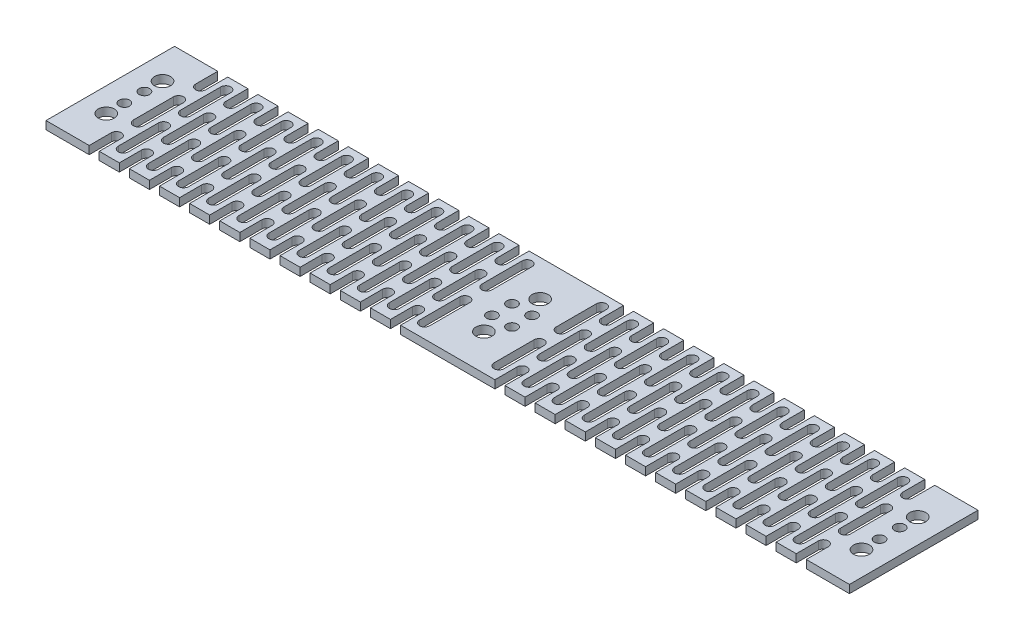
from build123d import *

# Parameters (mm, degrees)
SKETCH_1_W          = 100
SKETCH_1_H          = 16
EXTRUDE_1_DEPTH     = 1
SKETCH_2_R          = 1
SKETCH_2_R_2        = 0.65
CUT_EXTRUDE_1_DEPTH = 51.645829048
CUT_EXTRUDE_2_DEPTH = 51.645829048


with BuildPart() as part:
    # 스케치1 → 보스-돌출1 (new body)
    with BuildSketch(Plane(origin=(0, 0, 0), x_dir=(1, 0, 0), z_dir=(0, 1, 0))):
        Rectangle(SKETCH_1_W, SKETCH_1_H)
    extrude(amount=EXTRUDE_1_DEPTH)

    # 스케치2 → 컷-돌출1 (cut, through all)
    with BuildSketch(Plane(origin=(0, 1, 0), x_dir=(1, 0, 0), z_dir=(0, 1, 0))):
        with Locations(Location((47, 3.5, 0), (0, 0, 270))):
            Circle(SKETCH_2_R)
        with Locations(Location((0, 3.5, 0), (0, 0, 270))):
            Circle(SKETCH_2_R)
        with Locations(Location((-47, 3.5, 0), (0, 0, 270))):
            Circle(SKETCH_2_R)
        with Locations(Location((47, 1.25, 0), (0, 0, 270))):
            Circle(SKETCH_2_R_2)
        with Locations(Location((-47, 1.25, 0), (0, 0, 90))):
            Circle(SKETCH_2_R_2)
        with Locations(Location((1.25, 1.25, 0), (0, 0, 270))):
            Circle(SKETCH_2_R_2)
        with Locations(Location((-1.25, 1.25, 0), (0, 0, 270))):
            Circle(SKETCH_2_R_2)
        with Locations(Location((47, -1.25, 0), (0, 0, 90))):
            Circle(SKETCH_2_R_2)
        with Locations(Location((47, -3.5, 0), (0, 0, 90))):
            Circle(SKETCH_2_R)
        with Locations(Location((-1.25, -1.25, 0), (0, 0, 90))):
            Circle(SKETCH_2_R_2)
        with Locations(Location((1.25, -1.25, 0), (0, 0, 90))):
            Circle(SKETCH_2_R_2)
        with Locations(Location((0, -3.5, 0), (0, 0, 90))):
            Circle(SKETCH_2_R)
        with Locations(Location((-47, -1.25, 0), (0, 0, 270))):
            Circle(SKETCH_2_R_2)
        with Locations(Location((-47, -3.5, 0), (0, 0, 90))):
            Circle(SKETCH_2_R)
    extrude(amount=-CUT_EXTRUDE_1_DEPTH, mode=Mode.SUBTRACT)

    # 스케치3 → 컷-돌출2 (cut, through all)
    with BuildSketch(Plane(origin=(0, 1, 0), x_dir=(1, 0, 0), z_dir=(0, 1, 0))):
        with BuildLine():
            Line((44.625, 2.5), (44.625, -2.5))
            ThreePointArc((44.625, -2.5), (44, -3.125), (43.375, -2.5))
            Line((43.375, -2.5), (43.375, 2.5))
            ThreePointArc((43.375, 2.5), (44, 3.125), (44.625, 2.5))
        make_face()
        with BuildLine():
            Line((40.875, 2.5), (40.875, -2.5))
            ThreePointArc((40.875, -2.5), (40.25, -3.125), (39.625, -2.5))
            Line((39.625, -2.5), (39.625, 2.5))
            ThreePointArc((39.625, 2.5), (40.25, 3.125), (40.875, 2.5))
        make_face()
        with BuildLine():
            Line((37.125, 2.5), (37.125, -2.5))
            ThreePointArc((37.125, -2.5), (36.5, -3.125), (35.875, -2.5))
            Line((35.875, -2.5), (35.875, 2.5))
            ThreePointArc((35.875, 2.5), (36.5, 3.125), (37.125, 2.5))
        make_face()
        with BuildLine():
            Line((33.375, 2.5), (33.375, -2.5))
            ThreePointArc((33.375, -2.5), (32.75, -3.125), (32.125, -2.5))
            Line((32.125, -2.5), (32.125, 2.5))
            ThreePointArc((32.125, 2.5), (32.75, 3.125), (33.375, 2.5))
        make_face()
        with BuildLine():
            Line((29.625, 2.5), (29.625, -2.5))
            ThreePointArc((29.625, -2.5), (29, -3.125), (28.375, -2.5))
            Line((28.375, -2.5), (28.375, 2.5))
            ThreePointArc((28.375, 2.5), (29, 3.125), (29.625, 2.5))
        make_face()
        with BuildLine():
            Line((25.875, 2.5), (25.875, -2.5))
            ThreePointArc((25.875, -2.5), (25.25, -3.125), (24.625, -2.5))
            Line((24.625, -2.5), (24.625, 2.5))
            ThreePointArc((24.625, 2.5), (25.25, 3.125), (25.875, 2.5))
        make_face()
        with BuildLine():
            Line((22.125, 2.5), (22.125, -2.5))
            ThreePointArc((22.125, -2.5), (21.5, -3.125), (20.875, -2.5))
            Line((20.875, -2.5), (20.875, 2.5))
            ThreePointArc((20.875, 2.5), (21.5, 3.125), (22.125, 2.5))
        make_face()
        with BuildLine():
            Line((18.375, 2.5), (18.375, -2.5))
            ThreePointArc((18.375, -2.5), (17.75, -3.125), (17.125, -2.5))
            Line((17.125, -2.5), (17.125, 2.5))
            ThreePointArc((17.125, 2.5), (17.75, 3.125), (18.375, 2.5))
        make_face()
        with BuildLine():
            Line((14.625, 2.5), (14.625, -2.5))
            ThreePointArc((14.625, -2.5), (14, -3.125), (13.375, -2.5))
            Line((13.375, -2.5), (13.375, 2.5))
            ThreePointArc((13.375, 2.5), (14, 3.125), (14.625, 2.5))
        make_face()
        with BuildLine():
            Line((10.875, 2.5), (10.875, -2.5))
            ThreePointArc((10.875, -2.5), (10.25, -3.125), (9.625, -2.5))
            Line((9.625, -2.5), (9.625, 2.5))
            ThreePointArc((9.625, 2.5), (10.25, 3.125), (10.875, 2.5))
        make_face()
        with BuildLine():
            Line((7.125, 2.5), (7.125, -2.5))
            ThreePointArc((7.125, -2.5), (6.5, -3.125), (5.875, -2.5))
            Line((5.875, -2.5), (5.875, 2.5))
            ThreePointArc((5.875, 2.5), (6.5, 3.125), (7.125, 2.5))
        make_face()
        with BuildLine():
            Line((40.875, 10.25), (40.875, 5.25))
            ThreePointArc((40.875, 5.25), (40.25, 4.625), (39.625, 5.25))
            Line((39.625, 5.25), (39.625, 10.25))
            ThreePointArc((39.625, 10.25), (40.25, 10.875), (40.875, 10.25))
        make_face()
        with BuildLine():
            Line((37.125, 10.25), (37.125, 5.25))
            ThreePointArc((37.125, 5.25), (36.5, 4.625), (35.875, 5.25))
            Line((35.875, 5.25), (35.875, 10.25))
            ThreePointArc((35.875, 10.25), (36.5, 10.875), (37.125, 10.25))
        make_face()
        with BuildLine():
            Line((33.375, 10.25), (33.375, 5.25))
            ThreePointArc((33.375, 5.25), (32.75, 4.625), (32.125, 5.25))
            Line((32.125, 5.25), (32.125, 10.25))
            ThreePointArc((32.125, 10.25), (32.75, 10.875), (33.375, 10.25))
        make_face()
        with BuildLine():
            Line((29.625, 10.25), (29.625, 5.25))
            ThreePointArc((29.625, 5.25), (29, 4.625), (28.375, 5.25))
            Line((28.375, 5.25), (28.375, 10.25))
            ThreePointArc((28.375, 10.25), (29, 10.875), (29.625, 10.25))
        make_face()
        with BuildLine():
            Line((25.875, 10.25), (25.875, 5.25))
            ThreePointArc((25.875, 5.25), (25.25, 4.625), (24.625, 5.25))
            Line((24.625, 5.25), (24.625, 10.25))
            ThreePointArc((24.625, 10.25), (25.25, 10.875), (25.875, 10.25))
        make_face()
        with BuildLine():
            Line((22.125, 10.25), (22.125, 5.25))
            ThreePointArc((22.125, 5.25), (21.5, 4.625), (20.875, 5.25))
            Line((20.875, 5.25), (20.875, 10.25))
            ThreePointArc((20.875, 10.25), (21.5, 10.875), (22.125, 10.25))
        make_face()
        with BuildLine():
            Line((18.375, 10.25), (18.375, 5.25))
            ThreePointArc((18.375, 5.25), (17.75, 4.625), (17.125, 5.25))
            Line((17.125, 5.25), (17.125, 10.25))
            ThreePointArc((17.125, 10.25), (17.75, 10.875), (18.375, 10.25))
        make_face()
        with BuildLine():
            Line((14.625, 10.25), (14.625, 5.25))
            ThreePointArc((14.625, 5.25), (14, 4.625), (13.375, 5.25))
            Line((13.375, 5.25), (13.375, 10.25))
            ThreePointArc((13.375, 10.25), (14, 10.875), (14.625, 10.25))
        make_face()
        with BuildLine():
            Line((10.875, 10.25), (10.875, 5.25))
            ThreePointArc((10.875, 5.25), (10.25, 4.625), (9.625, 5.25))
            Line((9.625, 5.25), (9.625, 10.25))
            ThreePointArc((9.625, 10.25), (10.25, 10.875), (10.875, 10.25))
        make_face()
        with BuildLine():
            Line((7.125, 10.25), (7.125, 5.25))
            ThreePointArc((7.125, 5.25), (6.5, 4.625), (5.875, 5.25))
            Line((5.875, 5.25), (5.875, 10.25))
            ThreePointArc((5.875, 10.25), (6.5, 10.875), (7.125, 10.25))
        make_face()
        with BuildLine():
            Line((44.625, 10.25), (44.625, 5.25))
            ThreePointArc((44.625, 5.25), (44, 4.625), (43.375, 5.25))
            Line((43.375, 5.25), (43.375, 10.25))
            ThreePointArc((43.375, 10.25), (44, 10.875), (44.625, 10.25))
        make_face()
        with BuildLine():
            Line((44.625, -10.25), (44.625, -5.25))
            ThreePointArc((44.625, -5.25), (44, -4.625), (43.375, -5.25))
            Line((43.375, -5.25), (43.375, -10.25))
            ThreePointArc((43.375, -10.25), (44, -10.875), (44.625, -10.25))
        make_face()
        with BuildLine():
            Line((7.125, -10.25), (7.125, -5.25))
            ThreePointArc((7.125, -5.25), (6.5, -4.625), (5.875, -5.25))
            Line((5.875, -5.25), (5.875, -10.25))
            ThreePointArc((5.875, -10.25), (6.5, -10.875), (7.125, -10.25))
        make_face()
        with BuildLine():
            Line((10.875, -10.25), (10.875, -5.25))
            ThreePointArc((10.875, -5.25), (10.25, -4.625), (9.625, -5.25))
            Line((9.625, -5.25), (9.625, -10.25))
            ThreePointArc((9.625, -10.25), (10.25, -10.875), (10.875, -10.25))
        make_face()
        with BuildLine():
            Line((14.625, -10.25), (14.625, -5.25))
            ThreePointArc((14.625, -5.25), (14, -4.625), (13.375, -5.25))
            Line((13.375, -5.25), (13.375, -10.25))
            ThreePointArc((13.375, -10.25), (14, -10.875), (14.625, -10.25))
        make_face()
        with BuildLine():
            Line((18.375, -10.25), (18.375, -5.25))
            ThreePointArc((18.375, -5.25), (17.75, -4.625), (17.125, -5.25))
            Line((17.125, -5.25), (17.125, -10.25))
            ThreePointArc((17.125, -10.25), (17.75, -10.875), (18.375, -10.25))
        make_face()
        with BuildLine():
            Line((22.125, -10.25), (22.125, -5.25))
            ThreePointArc((22.125, -5.25), (21.5, -4.625), (20.875, -5.25))
            Line((20.875, -5.25), (20.875, -10.25))
            ThreePointArc((20.875, -10.25), (21.5, -10.875), (22.125, -10.25))
        make_face()
        with BuildLine():
            Line((25.875, -10.25), (25.875, -5.25))
            ThreePointArc((25.875, -5.25), (25.25, -4.625), (24.625, -5.25))
            Line((24.625, -5.25), (24.625, -10.25))
            ThreePointArc((24.625, -10.25), (25.25, -10.875), (25.875, -10.25))
        make_face()
        with BuildLine():
            Line((29.625, -10.25), (29.625, -5.25))
            ThreePointArc((29.625, -5.25), (29, -4.625), (28.375, -5.25))
            Line((28.375, -5.25), (28.375, -10.25))
            ThreePointArc((28.375, -10.25), (29, -10.875), (29.625, -10.25))
        make_face()
        with BuildLine():
            Line((33.375, -10.25), (33.375, -5.25))
            ThreePointArc((33.375, -5.25), (32.75, -4.625), (32.125, -5.25))
            Line((32.125, -5.25), (32.125, -10.25))
            ThreePointArc((32.125, -10.25), (32.75, -10.875), (33.375, -10.25))
        make_face()
        with BuildLine():
            Line((37.125, -10.25), (37.125, -5.25))
            ThreePointArc((37.125, -5.25), (36.5, -4.625), (35.875, -5.25))
            Line((35.875, -5.25), (35.875, -10.25))
            ThreePointArc((35.875, -10.25), (36.5, -10.875), (37.125, -10.25))
        make_face()
        with BuildLine():
            Line((40.875, -10.25), (40.875, -5.25))
            ThreePointArc((40.875, -5.25), (40.25, -4.625), (39.625, -5.25))
            Line((39.625, -5.25), (39.625, -10.25))
            ThreePointArc((39.625, -10.25), (40.25, -10.875), (40.875, -10.25))
        make_face()
        with BuildLine():
            Line((42.75, -1.25), (42.75, -6.25))
            ThreePointArc((42.75, -6.25), (42.125, -6.875), (41.5, -6.25))
            Line((41.5, -6.25), (41.5, -1.25))
            ThreePointArc((41.5, -1.25), (42.125, -0.625), (42.75, -1.25))
        make_face()
        with BuildLine():
            Line((39, -1.25), (39, -6.25))
            ThreePointArc((39, -6.25), (38.375, -6.875), (37.75, -6.25))
            Line((37.75, -6.25), (37.75, -1.25))
            ThreePointArc((37.75, -1.25), (38.375, -0.625), (39, -1.25))
        make_face()
        with BuildLine():
            Line((35.25, -1.25), (35.25, -6.25))
            ThreePointArc((35.25, -6.25), (34.625, -6.875), (34, -6.25))
            Line((34, -6.25), (34, -1.25))
            ThreePointArc((34, -1.25), (34.625, -0.625), (35.25, -1.25))
        make_face()
        with BuildLine():
            Line((31.5, -1.25), (31.5, -6.25))
            ThreePointArc((31.5, -6.25), (30.875, -6.875), (30.25, -6.25))
            Line((30.25, -6.25), (30.25, -1.25))
            ThreePointArc((30.25, -1.25), (30.875, -0.625), (31.5, -1.25))
        make_face()
        with BuildLine():
            Line((27.75, -1.25), (27.75, -6.25))
            ThreePointArc((27.75, -6.25), (27.125, -6.875), (26.5, -6.25))
            Line((26.5, -6.25), (26.5, -1.25))
            ThreePointArc((26.5, -1.25), (27.125, -0.625), (27.75, -1.25))
        make_face()
        with BuildLine():
            Line((24, -1.25), (24, -6.25))
            ThreePointArc((24, -6.25), (23.375, -6.875), (22.75, -6.25))
            Line((22.75, -6.25), (22.75, -1.25))
            ThreePointArc((22.75, -1.25), (23.375, -0.625), (24, -1.25))
        make_face()
        with BuildLine():
            Line((20.25, -1.25), (20.25, -6.25))
            ThreePointArc((20.25, -6.25), (19.625, -6.875), (19, -6.25))
            Line((19, -6.25), (19, -1.25))
            ThreePointArc((19, -1.25), (19.625, -0.625), (20.25, -1.25))
        make_face()
        with BuildLine():
            Line((16.5, -1.25), (16.5, -6.25))
            ThreePointArc((16.5, -6.25), (15.875, -6.875), (15.25, -6.25))
            Line((15.25, -6.25), (15.25, -1.25))
            ThreePointArc((15.25, -1.25), (15.875, -0.625), (16.5, -1.25))
        make_face()
        with BuildLine():
            Line((12.75, -1.25), (12.75, -6.25))
            ThreePointArc((12.75, -6.25), (12.125, -6.875), (11.5, -6.25))
            Line((11.5, -6.25), (11.5, -1.25))
            ThreePointArc((11.5, -1.25), (12.125, -0.625), (12.75, -1.25))
        make_face()
        with BuildLine():
            Line((9, -1.25), (9, -6.25))
            ThreePointArc((9, -6.25), (8.375, -6.875), (7.75, -6.25))
            Line((7.75, -6.25), (7.75, -1.25))
            ThreePointArc((7.75, -1.25), (8.375, -0.625), (9, -1.25))
        make_face()
        with BuildLine():
            Line((5.25, -1.25), (5.25, -6.25))
            ThreePointArc((5.25, -6.25), (4.625, -6.875), (4, -6.25))
            Line((4, -6.25), (4, -1.25))
            ThreePointArc((4, -1.25), (4.625, -0.625), (5.25, -1.25))
        make_face()
        with BuildLine():
            Line((39, 6.5), (39, 1.5))
            ThreePointArc((39, 1.5), (38.375, 0.875), (37.75, 1.5))
            Line((37.75, 1.5), (37.75, 6.5))
            ThreePointArc((37.75, 6.5), (38.375, 7.125), (39, 6.5))
        make_face()
        with BuildLine():
            Line((35.25, 6.5), (35.25, 1.5))
            ThreePointArc((35.25, 1.5), (34.625, 0.875), (34, 1.5))
            Line((34, 1.5), (34, 6.5))
            ThreePointArc((34, 6.5), (34.625, 7.125), (35.25, 6.5))
        make_face()
        with BuildLine():
            Line((31.5, 6.5), (31.5, 1.5))
            ThreePointArc((31.5, 1.5), (30.875, 0.875), (30.25, 1.5))
            Line((30.25, 1.5), (30.25, 6.5))
            ThreePointArc((30.25, 6.5), (30.875, 7.125), (31.5, 6.5))
        make_face()
        with BuildLine():
            Line((27.75, 6.5), (27.75, 1.5))
            ThreePointArc((27.75, 1.5), (27.125, 0.875), (26.5, 1.5))
            Line((26.5, 1.5), (26.5, 6.5))
            ThreePointArc((26.5, 6.5), (27.125, 7.125), (27.75, 6.5))
        make_face()
        with BuildLine():
            Line((24, 6.5), (24, 1.5))
            ThreePointArc((24, 1.5), (23.375, 0.875), (22.75, 1.5))
            Line((22.75, 1.5), (22.75, 6.5))
            ThreePointArc((22.75, 6.5), (23.375, 7.125), (24, 6.5))
        make_face()
        with BuildLine():
            Line((20.25, 6.5), (20.25, 1.5))
            ThreePointArc((20.25, 1.5), (19.625, 0.875), (19, 1.5))
            Line((19, 1.5), (19, 6.5))
            ThreePointArc((19, 6.5), (19.625, 7.125), (20.25, 6.5))
        make_face()
        with BuildLine():
            Line((16.5, 6.5), (16.5, 1.5))
            ThreePointArc((16.5, 1.5), (15.875, 0.875), (15.25, 1.5))
            Line((15.25, 1.5), (15.25, 6.5))
            ThreePointArc((15.25, 6.5), (15.875, 7.125), (16.5, 6.5))
        make_face()
        with BuildLine():
            Line((12.75, 6.5), (12.75, 1.5))
            ThreePointArc((12.75, 1.5), (12.125, 0.875), (11.5, 1.5))
            Line((11.5, 1.5), (11.5, 6.5))
            ThreePointArc((11.5, 6.5), (12.125, 7.125), (12.75, 6.5))
        make_face()
        with BuildLine():
            Line((9, 6.5), (9, 1.5))
            ThreePointArc((9, 1.5), (8.375, 0.875), (7.75, 1.5))
            Line((7.75, 1.5), (7.75, 6.5))
            ThreePointArc((7.75, 6.5), (8.375, 7.125), (9, 6.5))
        make_face()
        with BuildLine():
            Line((5.25, 6.5), (5.25, 1.5))
            ThreePointArc((5.25, 1.5), (4.625, 0.875), (4, 1.5))
            Line((4, 1.5), (4, 6.5))
            ThreePointArc((4, 6.5), (4.625, 7.125), (5.25, 6.5))
        make_face()
        with BuildLine():
            Line((42.75, 6.5), (42.75, 1.5))
            ThreePointArc((42.75, 1.5), (42.125, 0.875), (41.5, 1.5))
            Line((41.5, 1.5), (41.5, 6.5))
            ThreePointArc((41.5, 6.5), (42.125, 7.125), (42.75, 6.5))
        make_face()
        with BuildLine():
            Line((-42.75, 6.5), (-42.75, 1.5))
            ThreePointArc((-42.75, 1.5), (-42.125, 0.875), (-41.5, 1.5))
            Line((-41.5, 1.5), (-41.5, 6.5))
            ThreePointArc((-41.5, 6.5), (-42.125, 7.125), (-42.75, 6.5))
        make_face()
        with BuildLine():
            Line((-5.25, 6.5), (-5.25, 1.5))
            ThreePointArc((-5.25, 1.5), (-4.625, 0.875), (-4, 1.5))
            Line((-4, 1.5), (-4, 6.5))
            ThreePointArc((-4, 6.5), (-4.625, 7.125), (-5.25, 6.5))
        make_face()
        with BuildLine():
            Line((-9, 6.5), (-9, 1.5))
            ThreePointArc((-9, 1.5), (-8.375, 0.875), (-7.75, 1.5))
            Line((-7.75, 1.5), (-7.75, 6.5))
            ThreePointArc((-7.75, 6.5), (-8.375, 7.125), (-9, 6.5))
        make_face()
        with BuildLine():
            Line((-12.75, 6.5), (-12.75, 1.5))
            ThreePointArc((-12.75, 1.5), (-12.125, 0.875), (-11.5, 1.5))
            Line((-11.5, 1.5), (-11.5, 6.5))
            ThreePointArc((-11.5, 6.5), (-12.125, 7.125), (-12.75, 6.5))
        make_face()
        with BuildLine():
            Line((-16.5, 6.5), (-16.5, 1.5))
            ThreePointArc((-16.5, 1.5), (-15.875, 0.875), (-15.25, 1.5))
            Line((-15.25, 1.5), (-15.25, 6.5))
            ThreePointArc((-15.25, 6.5), (-15.875, 7.125), (-16.5, 6.5))
        make_face()
        with BuildLine():
            Line((-20.25, 6.5), (-20.25, 1.5))
            ThreePointArc((-20.25, 1.5), (-19.625, 0.875), (-19, 1.5))
            Line((-19, 1.5), (-19, 6.5))
            ThreePointArc((-19, 6.5), (-19.625, 7.125), (-20.25, 6.5))
        make_face()
        with BuildLine():
            Line((-24, 6.5), (-24, 1.5))
            ThreePointArc((-24, 1.5), (-23.375, 0.875), (-22.75, 1.5))
            Line((-22.75, 1.5), (-22.75, 6.5))
            ThreePointArc((-22.75, 6.5), (-23.375, 7.125), (-24, 6.5))
        make_face()
        with BuildLine():
            Line((-27.75, 6.5), (-27.75, 1.5))
            ThreePointArc((-27.75, 1.5), (-27.125, 0.875), (-26.5, 1.5))
            Line((-26.5, 1.5), (-26.5, 6.5))
            ThreePointArc((-26.5, 6.5), (-27.125, 7.125), (-27.75, 6.5))
        make_face()
        with BuildLine():
            Line((-31.5, 6.5), (-31.5, 1.5))
            ThreePointArc((-31.5, 1.5), (-30.875, 0.875), (-30.25, 1.5))
            Line((-30.25, 1.5), (-30.25, 6.5))
            ThreePointArc((-30.25, 6.5), (-30.875, 7.125), (-31.5, 6.5))
        make_face()
        with BuildLine():
            Line((-35.25, 6.5), (-35.25, 1.5))
            ThreePointArc((-35.25, 1.5), (-34.625, 0.875), (-34, 1.5))
            Line((-34, 1.5), (-34, 6.5))
            ThreePointArc((-34, 6.5), (-34.625, 7.125), (-35.25, 6.5))
        make_face()
        with BuildLine():
            Line((-39, 6.5), (-39, 1.5))
            ThreePointArc((-39, 1.5), (-38.375, 0.875), (-37.75, 1.5))
            Line((-37.75, 1.5), (-37.75, 6.5))
            ThreePointArc((-37.75, 6.5), (-38.375, 7.125), (-39, 6.5))
        make_face()
        with BuildLine():
            Line((-5.25, -1.25), (-5.25, -6.25))
            ThreePointArc((-5.25, -6.25), (-4.625, -6.875), (-4, -6.25))
            Line((-4, -6.25), (-4, -1.25))
            ThreePointArc((-4, -1.25), (-4.625, -0.625), (-5.25, -1.25))
        make_face()
        with BuildLine():
            Line((-9, -1.25), (-9, -6.25))
            ThreePointArc((-9, -6.25), (-8.375, -6.875), (-7.75, -6.25))
            Line((-7.75, -6.25), (-7.75, -1.25))
            ThreePointArc((-7.75, -1.25), (-8.375, -0.625), (-9, -1.25))
        make_face()
        with BuildLine():
            Line((-12.75, -1.25), (-12.75, -6.25))
            ThreePointArc((-12.75, -6.25), (-12.125, -6.875), (-11.5, -6.25))
            Line((-11.5, -6.25), (-11.5, -1.25))
            ThreePointArc((-11.5, -1.25), (-12.125, -0.625), (-12.75, -1.25))
        make_face()
        with BuildLine():
            Line((-16.5, -1.25), (-16.5, -6.25))
            ThreePointArc((-16.5, -6.25), (-15.875, -6.875), (-15.25, -6.25))
            Line((-15.25, -6.25), (-15.25, -1.25))
            ThreePointArc((-15.25, -1.25), (-15.875, -0.625), (-16.5, -1.25))
        make_face()
        with BuildLine():
            Line((-20.25, -1.25), (-20.25, -6.25))
            ThreePointArc((-20.25, -6.25), (-19.625, -6.875), (-19, -6.25))
            Line((-19, -6.25), (-19, -1.25))
            ThreePointArc((-19, -1.25), (-19.625, -0.625), (-20.25, -1.25))
        make_face()
        with BuildLine():
            Line((-24, -1.25), (-24, -6.25))
            ThreePointArc((-24, -6.25), (-23.375, -6.875), (-22.75, -6.25))
            Line((-22.75, -6.25), (-22.75, -1.25))
            ThreePointArc((-22.75, -1.25), (-23.375, -0.625), (-24, -1.25))
        make_face()
        with BuildLine():
            Line((-27.75, -1.25), (-27.75, -6.25))
            ThreePointArc((-27.75, -6.25), (-27.125, -6.875), (-26.5, -6.25))
            Line((-26.5, -6.25), (-26.5, -1.25))
            ThreePointArc((-26.5, -1.25), (-27.125, -0.625), (-27.75, -1.25))
        make_face()
        with BuildLine():
            Line((-31.5, -1.25), (-31.5, -6.25))
            ThreePointArc((-31.5, -6.25), (-30.875, -6.875), (-30.25, -6.25))
            Line((-30.25, -6.25), (-30.25, -1.25))
            ThreePointArc((-30.25, -1.25), (-30.875, -0.625), (-31.5, -1.25))
        make_face()
        with BuildLine():
            Line((-35.25, -1.25), (-35.25, -6.25))
            ThreePointArc((-35.25, -6.25), (-34.625, -6.875), (-34, -6.25))
            Line((-34, -6.25), (-34, -1.25))
            ThreePointArc((-34, -1.25), (-34.625, -0.625), (-35.25, -1.25))
        make_face()
        with BuildLine():
            Line((-39, -1.25), (-39, -6.25))
            ThreePointArc((-39, -6.25), (-38.375, -6.875), (-37.75, -6.25))
            Line((-37.75, -6.25), (-37.75, -1.25))
            ThreePointArc((-37.75, -1.25), (-38.375, -0.625), (-39, -1.25))
        make_face()
        with BuildLine():
            Line((-42.75, -1.25), (-42.75, -6.25))
            ThreePointArc((-42.75, -6.25), (-42.125, -6.875), (-41.5, -6.25))
            Line((-41.5, -6.25), (-41.5, -1.25))
            ThreePointArc((-41.5, -1.25), (-42.125, -0.625), (-42.75, -1.25))
        make_face()
        with BuildLine():
            Line((-40.875, -10.25), (-40.875, -5.25))
            ThreePointArc((-40.875, -5.25), (-40.25, -4.625), (-39.625, -5.25))
            Line((-39.625, -5.25), (-39.625, -10.25))
            ThreePointArc((-39.625, -10.25), (-40.25, -10.875), (-40.875, -10.25))
        make_face()
        with BuildLine():
            Line((-37.125, -10.25), (-37.125, -5.25))
            ThreePointArc((-37.125, -5.25), (-36.5, -4.625), (-35.875, -5.25))
            Line((-35.875, -5.25), (-35.875, -10.25))
            ThreePointArc((-35.875, -10.25), (-36.5, -10.875), (-37.125, -10.25))
        make_face()
        with BuildLine():
            Line((-33.375, -10.25), (-33.375, -5.25))
            ThreePointArc((-33.375, -5.25), (-32.75, -4.625), (-32.125, -5.25))
            Line((-32.125, -5.25), (-32.125, -10.25))
            ThreePointArc((-32.125, -10.25), (-32.75, -10.875), (-33.375, -10.25))
        make_face()
        with BuildLine():
            Line((-29.625, -10.25), (-29.625, -5.25))
            ThreePointArc((-29.625, -5.25), (-29, -4.625), (-28.375, -5.25))
            Line((-28.375, -5.25), (-28.375, -10.25))
            ThreePointArc((-28.375, -10.25), (-29, -10.875), (-29.625, -10.25))
        make_face()
        with BuildLine():
            Line((-25.875, -10.25), (-25.875, -5.25))
            ThreePointArc((-25.875, -5.25), (-25.25, -4.625), (-24.625, -5.25))
            Line((-24.625, -5.25), (-24.625, -10.25))
            ThreePointArc((-24.625, -10.25), (-25.25, -10.875), (-25.875, -10.25))
        make_face()
        with BuildLine():
            Line((-22.125, -10.25), (-22.125, -5.25))
            ThreePointArc((-22.125, -5.25), (-21.5, -4.625), (-20.875, -5.25))
            Line((-20.875, -5.25), (-20.875, -10.25))
            ThreePointArc((-20.875, -10.25), (-21.5, -10.875), (-22.125, -10.25))
        make_face()
        with BuildLine():
            Line((-18.375, -10.25), (-18.375, -5.25))
            ThreePointArc((-18.375, -5.25), (-17.75, -4.625), (-17.125, -5.25))
            Line((-17.125, -5.25), (-17.125, -10.25))
            ThreePointArc((-17.125, -10.25), (-17.75, -10.875), (-18.375, -10.25))
        make_face()
        with BuildLine():
            Line((-14.625, -10.25), (-14.625, -5.25))
            ThreePointArc((-14.625, -5.25), (-14, -4.625), (-13.375, -5.25))
            Line((-13.375, -5.25), (-13.375, -10.25))
            ThreePointArc((-13.375, -10.25), (-14, -10.875), (-14.625, -10.25))
        make_face()
        with BuildLine():
            Line((-10.875, -10.25), (-10.875, -5.25))
            ThreePointArc((-10.875, -5.25), (-10.25, -4.625), (-9.625, -5.25))
            Line((-9.625, -5.25), (-9.625, -10.25))
            ThreePointArc((-9.625, -10.25), (-10.25, -10.875), (-10.875, -10.25))
        make_face()
        with BuildLine():
            Line((-7.125, -10.25), (-7.125, -5.25))
            ThreePointArc((-7.125, -5.25), (-6.5, -4.625), (-5.875, -5.25))
            Line((-5.875, -5.25), (-5.875, -10.25))
            ThreePointArc((-5.875, -10.25), (-6.5, -10.875), (-7.125, -10.25))
        make_face()
        with BuildLine():
            Line((-44.625, -10.25), (-44.625, -5.25))
            ThreePointArc((-44.625, -5.25), (-44, -4.625), (-43.375, -5.25))
            Line((-43.375, -5.25), (-43.375, -10.25))
            ThreePointArc((-43.375, -10.25), (-44, -10.875), (-44.625, -10.25))
        make_face()
        with BuildLine():
            Line((-44.625, 10.25), (-44.625, 5.25))
            ThreePointArc((-44.625, 5.25), (-44, 4.625), (-43.375, 5.25))
            Line((-43.375, 5.25), (-43.375, 10.25))
            ThreePointArc((-43.375, 10.25), (-44, 10.875), (-44.625, 10.25))
        make_face()
        with BuildLine():
            Line((-7.125, 10.25), (-7.125, 5.25))
            ThreePointArc((-7.125, 5.25), (-6.5, 4.625), (-5.875, 5.25))
            Line((-5.875, 5.25), (-5.875, 10.25))
            ThreePointArc((-5.875, 10.25), (-6.5, 10.875), (-7.125, 10.25))
        make_face()
        with BuildLine():
            Line((-10.875, 10.25), (-10.875, 5.25))
            ThreePointArc((-10.875, 5.25), (-10.25, 4.625), (-9.625, 5.25))
            Line((-9.625, 5.25), (-9.625, 10.25))
            ThreePointArc((-9.625, 10.25), (-10.25, 10.875), (-10.875, 10.25))
        make_face()
        with BuildLine():
            Line((-14.625, 10.25), (-14.625, 5.25))
            ThreePointArc((-14.625, 5.25), (-14, 4.625), (-13.375, 5.25))
            Line((-13.375, 5.25), (-13.375, 10.25))
            ThreePointArc((-13.375, 10.25), (-14, 10.875), (-14.625, 10.25))
        make_face()
        with BuildLine():
            Line((-18.375, 10.25), (-18.375, 5.25))
            ThreePointArc((-18.375, 5.25), (-17.75, 4.625), (-17.125, 5.25))
            Line((-17.125, 5.25), (-17.125, 10.25))
            ThreePointArc((-17.125, 10.25), (-17.75, 10.875), (-18.375, 10.25))
        make_face()
        with BuildLine():
            Line((-22.125, 10.25), (-22.125, 5.25))
            ThreePointArc((-22.125, 5.25), (-21.5, 4.625), (-20.875, 5.25))
            Line((-20.875, 5.25), (-20.875, 10.25))
            ThreePointArc((-20.875, 10.25), (-21.5, 10.875), (-22.125, 10.25))
        make_face()
        with BuildLine():
            Line((-25.875, 10.25), (-25.875, 5.25))
            ThreePointArc((-25.875, 5.25), (-25.25, 4.625), (-24.625, 5.25))
            Line((-24.625, 5.25), (-24.625, 10.25))
            ThreePointArc((-24.625, 10.25), (-25.25, 10.875), (-25.875, 10.25))
        make_face()
        with BuildLine():
            Line((-29.625, 10.25), (-29.625, 5.25))
            ThreePointArc((-29.625, 5.25), (-29, 4.625), (-28.375, 5.25))
            Line((-28.375, 5.25), (-28.375, 10.25))
            ThreePointArc((-28.375, 10.25), (-29, 10.875), (-29.625, 10.25))
        make_face()
        with BuildLine():
            Line((-33.375, 10.25), (-33.375, 5.25))
            ThreePointArc((-33.375, 5.25), (-32.75, 4.625), (-32.125, 5.25))
            Line((-32.125, 5.25), (-32.125, 10.25))
            ThreePointArc((-32.125, 10.25), (-32.75, 10.875), (-33.375, 10.25))
        make_face()
        with BuildLine():
            Line((-37.125, 10.25), (-37.125, 5.25))
            ThreePointArc((-37.125, 5.25), (-36.5, 4.625), (-35.875, 5.25))
            Line((-35.875, 5.25), (-35.875, 10.25))
            ThreePointArc((-35.875, 10.25), (-36.5, 10.875), (-37.125, 10.25))
        make_face()
        with BuildLine():
            Line((-40.875, 10.25), (-40.875, 5.25))
            ThreePointArc((-40.875, 5.25), (-40.25, 4.625), (-39.625, 5.25))
            Line((-39.625, 5.25), (-39.625, 10.25))
            ThreePointArc((-39.625, 10.25), (-40.25, 10.875), (-40.875, 10.25))
        make_face()
        with BuildLine():
            Line((-7.125, 2.5), (-7.125, -2.5))
            ThreePointArc((-7.125, -2.5), (-6.5, -3.125), (-5.875, -2.5))
            Line((-5.875, -2.5), (-5.875, 2.5))
            ThreePointArc((-5.875, 2.5), (-6.5, 3.125), (-7.125, 2.5))
        make_face()
        with BuildLine():
            Line((-10.875, 2.5), (-10.875, -2.5))
            ThreePointArc((-10.875, -2.5), (-10.25, -3.125), (-9.625, -2.5))
            Line((-9.625, -2.5), (-9.625, 2.5))
            ThreePointArc((-9.625, 2.5), (-10.25, 3.125), (-10.875, 2.5))
        make_face()
        with BuildLine():
            Line((-14.625, 2.5), (-14.625, -2.5))
            ThreePointArc((-14.625, -2.5), (-14, -3.125), (-13.375, -2.5))
            Line((-13.375, -2.5), (-13.375, 2.5))
            ThreePointArc((-13.375, 2.5), (-14, 3.125), (-14.625, 2.5))
        make_face()
        with BuildLine():
            Line((-18.375, 2.5), (-18.375, -2.5))
            ThreePointArc((-18.375, -2.5), (-17.75, -3.125), (-17.125, -2.5))
            Line((-17.125, -2.5), (-17.125, 2.5))
            ThreePointArc((-17.125, 2.5), (-17.75, 3.125), (-18.375, 2.5))
        make_face()
        with BuildLine():
            Line((-22.125, 2.5), (-22.125, -2.5))
            ThreePointArc((-22.125, -2.5), (-21.5, -3.125), (-20.875, -2.5))
            Line((-20.875, -2.5), (-20.875, 2.5))
            ThreePointArc((-20.875, 2.5), (-21.5, 3.125), (-22.125, 2.5))
        make_face()
        with BuildLine():
            Line((-25.875, 2.5), (-25.875, -2.5))
            ThreePointArc((-25.875, -2.5), (-25.25, -3.125), (-24.625, -2.5))
            Line((-24.625, -2.5), (-24.625, 2.5))
            ThreePointArc((-24.625, 2.5), (-25.25, 3.125), (-25.875, 2.5))
        make_face()
        with BuildLine():
            Line((-29.625, 2.5), (-29.625, -2.5))
            ThreePointArc((-29.625, -2.5), (-29, -3.125), (-28.375, -2.5))
            Line((-28.375, -2.5), (-28.375, 2.5))
            ThreePointArc((-28.375, 2.5), (-29, 3.125), (-29.625, 2.5))
        make_face()
        with BuildLine():
            Line((-33.375, 2.5), (-33.375, -2.5))
            ThreePointArc((-33.375, -2.5), (-32.75, -3.125), (-32.125, -2.5))
            Line((-32.125, -2.5), (-32.125, 2.5))
            ThreePointArc((-32.125, 2.5), (-32.75, 3.125), (-33.375, 2.5))
        make_face()
        with BuildLine():
            Line((-37.125, 2.5), (-37.125, -2.5))
            ThreePointArc((-37.125, -2.5), (-36.5, -3.125), (-35.875, -2.5))
            Line((-35.875, -2.5), (-35.875, 2.5))
            ThreePointArc((-35.875, 2.5), (-36.5, 3.125), (-37.125, 2.5))
        make_face()
        with BuildLine():
            Line((-40.875, 2.5), (-40.875, -2.5))
            ThreePointArc((-40.875, -2.5), (-40.25, -3.125), (-39.625, -2.5))
            Line((-39.625, -2.5), (-39.625, 2.5))
            ThreePointArc((-39.625, 2.5), (-40.25, 3.125), (-40.875, 2.5))
        make_face()
        with BuildLine():
            Line((-44.625, 2.5), (-44.625, -2.5))
            ThreePointArc((-44.625, -2.5), (-44, -3.125), (-43.375, -2.5))
            Line((-43.375, -2.5), (-43.375, 2.5))
            ThreePointArc((-43.375, 2.5), (-44, 3.125), (-44.625, 2.5))
        make_face()
    extrude(amount=-CUT_EXTRUDE_2_DEPTH, mode=Mode.SUBTRACT)


solid = part.part
